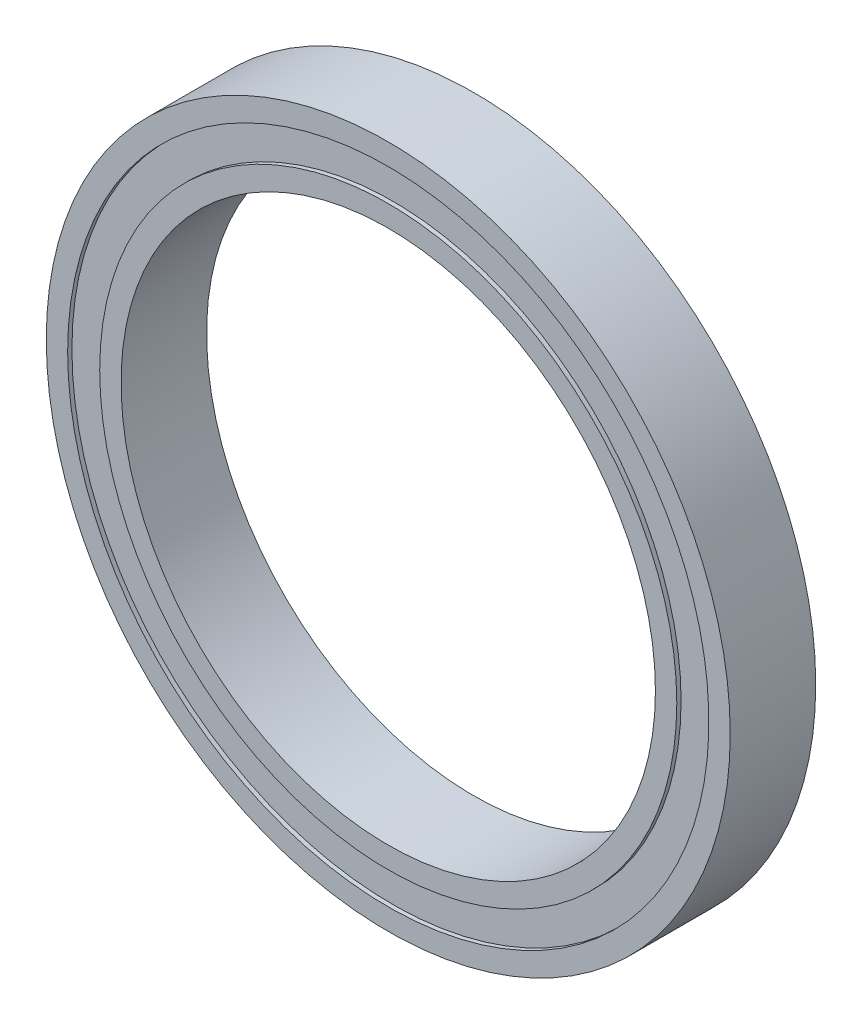
from build123d import *

# Parameters (mm, degrees)
ESQUISSE1_R        = 16
ESQUISSE1_R_2      = 12.5
BOSS_EXTRU_1_DEPTH = 2
ESQUISSE2_W        = 0.2
ESQUISSE2_H        = 1.5


with BuildPart() as part:
    # Esquisse1 → Boss.-Extru.1 (new, symmetric)
    with BuildSketch(Plane.XY):
        Circle(ESQUISSE1_R)
        Circle(ESQUISSE1_R_2, mode=Mode.SUBTRACT)
    extrude(amount=BOSS_EXTRU_1_DEPTH, both=True)

    # Esquisse2 → Enlèvement de matière-Révolution1 (revolve, cut)
    with BuildSketch(Plane(origin=(0, 0, 0), x_dir=(0, 0, -1), z_dir=(1, 0, 0)), mode=Mode.PRIVATE) as enl_vement_de_mati_re_r_volution1_sk:
        with Locations((-1.9, 14.25)):
            Rectangle(ESQUISSE2_W, ESQUISSE2_H)
        with Locations((1.9, 14.25)):
            Rectangle(ESQUISSE2_W, ESQUISSE2_H)
    revolve(enl_vement_de_mati_re_r_volution1_sk.sketch.rotate(Axis((0, 0, 0), (0, 0, 1)), 90), axis=Axis((0, 0, 0), (0, 0, 1)), mode=Mode.SUBTRACT)


solid = part.part
